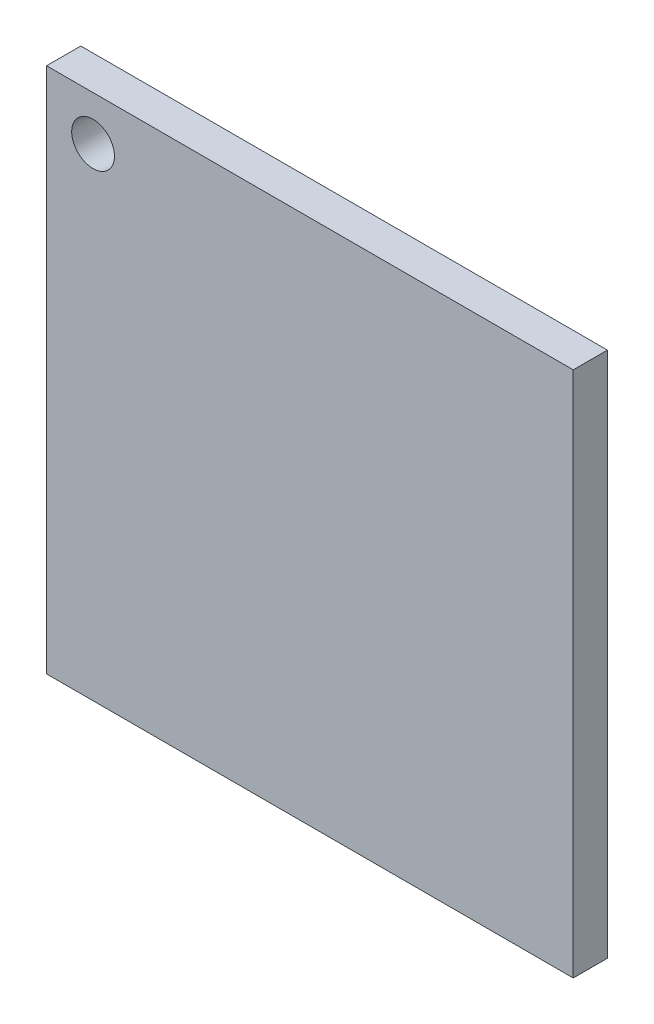
from build123d import *

# Parameters (mm, degrees)
SKETCH1_W           = 154
SKETCH1_H           = 154
SKETCH1_R           = 6.25
BOSS_EXTRUDE1_DEPTH = 10


with BuildPart() as part:
    # Sketch1 → Boss-Extrude1 (new body)
    with BuildSketch(Plane.XY):
        with Locations((77, -77)):
            Rectangle(SKETCH1_W, SKETCH1_H)
        with Locations((13.6, -13)):
            Circle(SKETCH1_R, mode=Mode.SUBTRACT)
    extrude(amount=BOSS_EXTRUDE1_DEPTH)


solid = part.part
